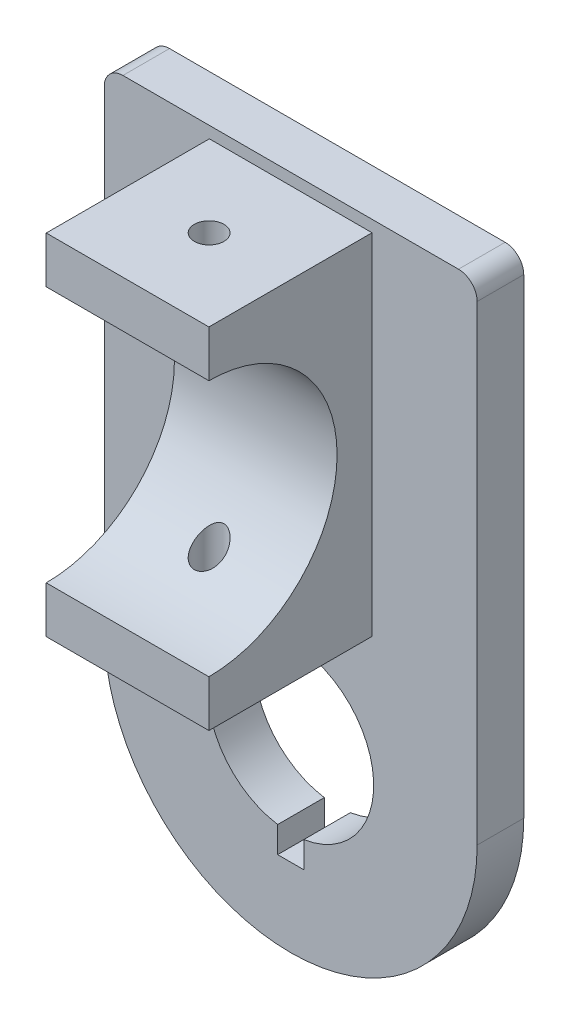
from build123d import *

# Parameters (mm, degrees)
BOSS_EXTRUDE1_DEPTH     = 6.35
SKETCH2_W               = 22.1615
SKETCH2_H               = 47.625
BOSS_EXTRUDE2_DEPTH     = 22.225
CUT_EXTRUDE1_DEPTH      = 82.196867985
CUT_EXTRUDE1_DEPTH_BACK = 82.196867985
SKETCH6_W               = 2.0193
SKETCH6_H               = 23.8125
SKETCH9_W               = 2.0193
SKETCH9_H               = 41.276


with BuildPart() as part:
    # Sketch1 → Boss-Extrude1 (new body)
    with BuildSketch(Plane.XY):
        with BuildLine():
            Line((0, 0), (0, 64.135))
            ThreePointArc((0, 64.135), (0.743948776, 65.931051224), (2.54, 66.675))
            Line((2.54, 66.675), (48.26, 66.675))
            ThreePointArc((48.26, 66.675), (50.056051224, 65.931051224), (50.8, 64.135))
            Line((50.8, 64.135), (50.8, 0))
            ThreePointArc((50.8, 0), (25.4, -25.4), (0, 0))
        make_face()
        with BuildLine():
            Line((23.622, -11.162281353), (23.622, -14.718281353))
            Line((23.622, -14.718281353), (27.178, -14.718281353))
            Line((27.178, -14.718281353), (27.178, -11.162281353))
            ThreePointArc((27.178, -11.162281353), (25.4, 11.303), (23.622, -11.162281353))
        make_face(mode=Mode.SUBTRACT)
    extrude(amount=BOSS_EXTRUDE1_DEPTH)


with BuildPart() as body_2:
    # Sketch2 → Boss-Extrude2 (new body)
    with BuildSketch(Plane.XY.offset(6.35)):
        with Locations((25.4, 41.275)):
            Rectangle(SKETCH2_W, SKETCH2_H)
    extrude(amount=BOSS_EXTRUDE2_DEPTH)

    # Sketch3 → Cut-Extrude1 (cut, two sides: drawn at the far end of the back side and taken through both)
    with BuildSketch(Plane.ZY.offset(-14.31925).offset(-CUT_EXTRUDE1_DEPTH_BACK)):
        with BuildLine():
            Line((216.289935008, 23.8125), (28.575, 23.8125))
            ThreePointArc((28.575, 23.8125), (11.1125, 41.275), (28.575, 58.7375))
            Line((28.575, 58.7375), (216.289935008, 58.7375))
            Line((216.289935008, 58.7375), (591.719805025, 58.7375))
            Line((591.719805025, 58.7375), (591.719805025, 23.8125))
            Line((591.719805025, 23.8125), (216.289935008, 23.8125))
        make_face()
    extrude(amount=CUT_EXTRUDE1_DEPTH + CUT_EXTRUDE1_DEPTH_BACK, mode=Mode.SUBTRACT)

    # Sketch6 → #10-32 Tapped Hole1 (revolve, cut)
    with BuildSketch(Plane(origin=(25.4, 65.0875, 17.4625), x_dir=(0, 0, 1), z_dir=(1, 0, 0))):
        with Locations((1.00965, 11.90625)):
            Rectangle(SKETCH6_W, SKETCH6_H)
    revolve(axis=Axis((25.4, 71.4375, 17.4625), (0, -1, 0)), mode=Mode.SUBTRACT)

    # Sketch9 → #10-32 Tapped Hole2 (revolve, cut)
    with BuildSketch(Plane(origin=(25.4, 17.4625, 17.4625), x_dir=(0, 0, -1), z_dir=(1, 0, 0))):
        with Locations((1.00965, 20.638)):
            Rectangle(SKETCH9_W, SKETCH9_H)
    revolve(axis=Axis((25.4, 11.1125, 17.4625), (0, 1, 0)), mode=Mode.SUBTRACT)


solid = Compound([part.part, body_2.part])
